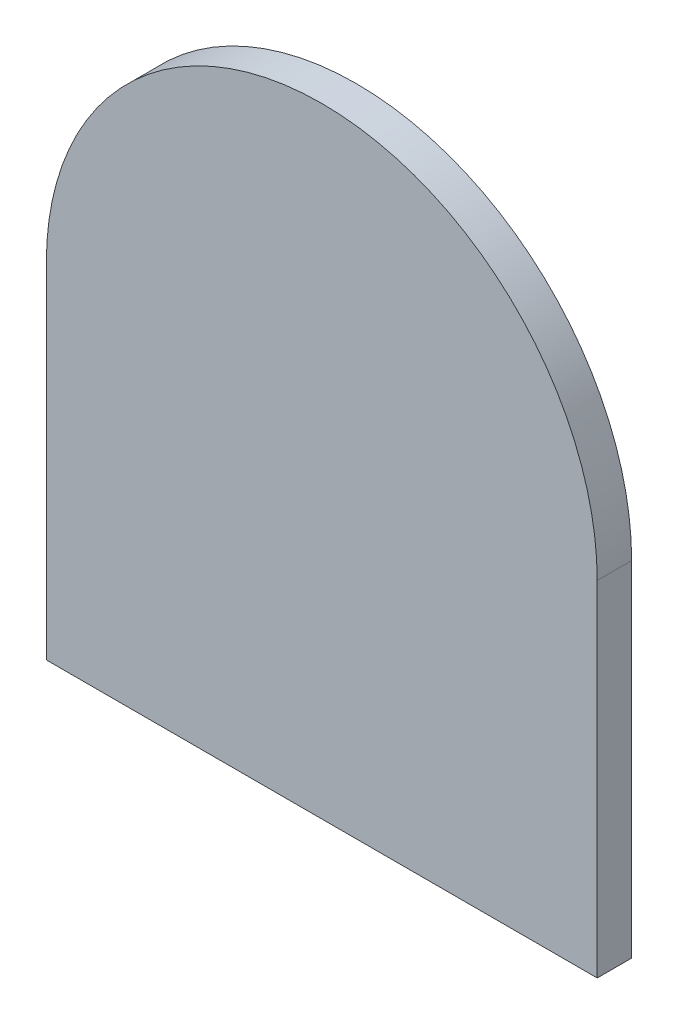
from build123d import *

# Parameters (mm, degrees)
BOSS_EXTRUDE1_DEPTH = 31.75


with BuildPart() as part:
    # Sketch1 → Boss-Extrude1 (new body)
    with BuildSketch(Plane.XY):
        with BuildLine():
            Line((-254, 0), (254, 0))
            Line((254, 0), (254, 317.5))
            ThreePointArc((254, 317.5), (0, 571.5), (-254, 317.5))
            Line((-254, 317.5), (-254, 0))
        make_face()
    extrude(amount=-BOSS_EXTRUDE1_DEPTH)


solid = part.part
